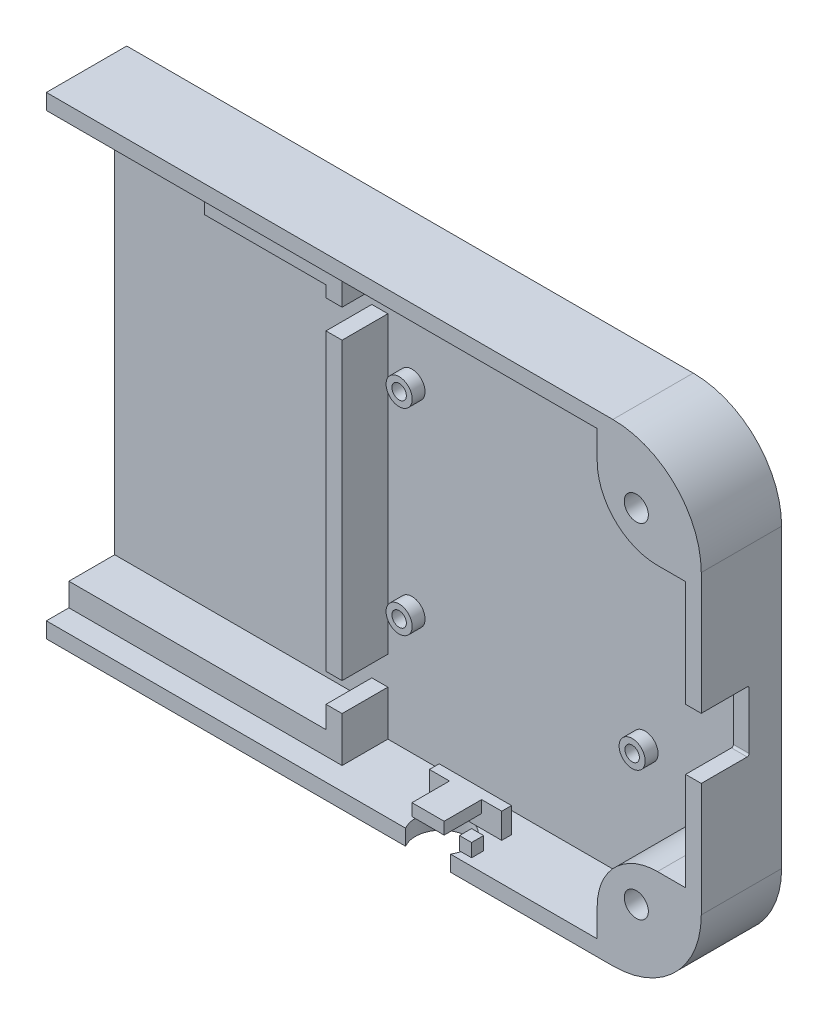
from build123d import *

# Parameters (mm, degrees)
SKETCH1_W               = 326
SKETCH1_H               = 117.8
SKETCH1_W_2             = 318.2
SKETCH1_H_2             = 110
BOSS_EXTRUDE1_DEPTH     = 20
SKETCH1_3_W             = 318.2
SKETCH1_3_H             = 110
BOSS_EXTRUDE2_DEPTH     = 3
BOSS_EXTRUDE6_START     = 3
SKETCH6_R               = 3.25
SKETCH6_R_2             = 1.8
BOSS_EXTRUDE6_DEPTH     = 3.2
FILLET1_R               = 22
CUT_EXTRUDE3_START      = 163
CUT_EXTRUDE3_DEPTH      = 3.9
CUT_EXTRUDE4_START      = 1.2
SKETCH6_2_R             = 1.8
CUT_EXTRUDE4_DEPTH      = 1.8
SKETCH5_W               = 64.404478897
SKETCH5_H               = 11.204693833
SKETCH5_W_2             = 4
SKETCH5_H_2             = 98.795306167
SKETCH5_W_3             = 30.218685567
SKETCH5_H_3             = 8.375486052
SKETCH5_H_4             = 73.388395798
SKETCH5_W_4             = 147.589311785
SKETCH5_H_5             = 5.740206696
BOSS_EXTRUDE7_DEPTH     = 14.4
CUT_EXTRUDE5_START      = -58.9
SKETCH10_R              = 6.5
CUT_EXTRUDE5_DEPTH      = 3.9
BOSS_EXTRUDE8_START     = -55
SKETCH11_W              = 18
SKETCH11_H              = 2.429995135
SKETCH11_W_2            = 3
SKETCH11_H_2            = 3
BOSS_EXTRUDE8_DEPTH     = 3.3
BOSS_EXTRUDE9_START     = -51.7
BOSS_EXTRUDE9_DEPTH     = 3
BOSS_EXTRUDE10_START    = 3
SKETCH12_R              = 3
BOSS_EXTRUDE10_DEPTH    = 17
SKETCH12_3_R            = 3
CUT_EXTRUDE6_DEPTH      = 6
SKETCH13_R              = 4.5
CUT_EXTRUDE7_DEPTH      = 4
CUT_EXTRUDE8_DEPTH      = 30
CUT_EXTRUDE8_DEPTH_BACK = 40
SKETCH14_W              = 179.941396495
SKETCH14_H              = 132.266113534


with BuildPart() as part:
    # Sketch1 → Boss-Extrude1 (new body)
    with BuildSketch(Plane.XY):
        Rectangle(SKETCH1_W, SKETCH1_H)
        Rectangle(SKETCH1_W_2, SKETCH1_H_2, mode=Mode.SUBTRACT)
    extrude(amount=BOSS_EXTRUDE1_DEPTH)

    # Sketch1<3> → Boss-Extrude2 (add)
    with BuildSketch(Plane.XY):
        Rectangle(SKETCH1_3_W, SKETCH1_3_H)
    extrude(amount=BOSS_EXTRUDE2_DEPTH)

    # Sketch6 → Boss-Extrude6 (add)
    # profile 1 of 4: a face of its own
    with BuildSketch(Plane.XY.offset(BOSS_EXTRUDE6_START)):
        with Locations((132, -24.5)):
            Circle(SKETCH6_R)
        with Locations((132, -24.5)):
            Circle(SKETCH6_R_2, mode=Mode.SUBTRACT)
    # profile 2 of 4: a face of its own
    with BuildSketch(Plane.XY.offset(BOSS_EXTRUDE6_START)):
        with Locations((74, -24.5)):
            Circle(SKETCH6_R)
        with Locations((74, -24.5)):
            Circle(SKETCH6_R_2, mode=Mode.SUBTRACT)
    # profile 3 of 4: a face of its own
    with BuildSketch(Plane.XY.offset(BOSS_EXTRUDE6_START)):
        with Locations((74, 24.5)):
            Circle(SKETCH6_R)
        with Locations((74, 24.5)):
            Circle(SKETCH6_R_2, mode=Mode.SUBTRACT)
    # profile 4 of 4: a face of its own
    with BuildSketch(Plane.XY.offset(BOSS_EXTRUDE6_START)):
        with Locations((132, 24.5)):
            Circle(SKETCH6_R)
        with Locations((132, 24.5)):
            Circle(SKETCH6_R_2, mode=Mode.SUBTRACT)
    extrude(amount=BOSS_EXTRUDE6_DEPTH)

    # Fillet1
    fillet1_edges = [part.edges().sort_by_distance(p)[0] for p in [
        (163, 58.9, 10),
        (163, -58.9, 10),
        (-163, -58.9, 10),
        (-163, 58.9, 10),
        (159.1, 55, 11.5),
        (-159.1, 55, 11.5),
        (-159.1, -55, 11.5),
        (159.1, -55, 11.5),
    ]]
    fillet(fillet1_edges, radius=FILLET1_R)

    # Sketch9 → Cut-Extrude3 (cut)
    with BuildSketch(Plane(origin=(0, 0, 0), x_dir=(0, 0, -1), z_dir=(1, 0, 0)).offset(CUT_EXTRUDE3_START)):
        with BuildLine():
            Line((-20, -8.55), (-8.58, -8.55))
            ThreePointArc((-8.58, -8.55), (-8.226446609, -8.403553391), (-8.08, -8.05))
            Line((-8.08, -8.05), (-8.08, 6.05))
            ThreePointArc((-8.08, 6.05), (-8.226446609, 6.403553391), (-8.58, 6.55))
            Line((-8.58, 6.55), (-20, 6.55))
            Line((-20, 6.55), (-20, -8.55))
        make_face()
    extrude(amount=-CUT_EXTRUDE3_DEPTH, mode=Mode.SUBTRACT)

    # Sketch6<2> → Cut-Extrude4 (cut)
    with BuildSketch(Plane.XY.offset(CUT_EXTRUDE4_START)):
        with Locations((132, -24.5)):
            Circle(SKETCH6_2_R)
        with Locations((132, 24.5)):
            Circle(SKETCH6_2_R)
        with Locations((74, 24.5)):
            Circle(SKETCH6_2_R)
        with Locations((74, -24.5)):
            Circle(SKETCH6_2_R)
    extrude(amount=CUT_EXTRUDE4_DEPTH, mode=Mode.SUBTRACT)

    # Sketch5 → Boss-Extrude7 (add)
    with BuildSketch(Plane.XY):
        with Locations((-66.797760552, 49.397653084)):
            Rectangle(SKETCH5_W, SKETCH5_H)
        with Locations((-101, 5.602346917)):
            Rectangle(SKETCH5_W_2, SKETCH5_H_2)
        with Locations((48.890657217, 50.812256974)):
            Rectangle(SKETCH5_W_3, SKETCH5_H_3)
        with Locations((66, 49.397653084)):
            Rectangle(SKETCH5_W_2, SKETCH5_H)
        with Locations((66, 0)):
            Rectangle(SKETCH5_W_2, SKETCH5_H_4)
        with Locations((-9.794655893, -52.129896652)):
            Rectangle(SKETCH5_W_4, SKETCH5_H_5)
        with Locations((66, -49.397653084)):
            Rectangle(SKETCH5_W_2, SKETCH5_H)
    extrude(amount=BOSS_EXTRUDE7_DEPTH)

    # Sketch10 → Cut-Extrude5 (cut)
    with BuildSketch(Plane(origin=(0, 0, 0), x_dir=(1, 0, 0), z_dir=(0, 1, 0)).offset(CUT_EXTRUDE5_START)):
        with Locations((95, -16.665643961)):
            Circle(SKETCH10_R)
        with Locations((-95, -16.665643961)):
            Circle(SKETCH10_R)
    extrude(amount=CUT_EXTRUDE5_DEPTH, mode=Mode.SUBTRACT)

    # Sketch11 → Boss-Extrude8 (add)
    with BuildSketch(Plane(origin=(0, 0, 0), x_dir=(1, 0, 0), z_dir=(0, 1, 0)).offset(BOSS_EXTRUDE8_START)):
        Polygon((-104.033941149, -14.931036323), (-101.03394878, -14.937802738), (-101.040715195, -17.937795107), (-104.040707565, -17.931028692), align=None)
        Polygon((-86.018356525, -8.041657306), (-104.018310741, -8.001058815), (-104.023791526, -10.431047769), (-86.023837311, -10.47164626), align=None)
        with Locations((95, -9.450646394)):
            Rectangle(SKETCH11_W, SKETCH11_H)
        with Locations((102.5, -16.665643961)):
            Rectangle(SKETCH11_W_2, SKETCH11_H_2)
    extrude(amount=BOSS_EXTRUDE8_DEPTH)

    # Sketch11<3> → Boss-Extrude9 (add)
    with BuildSketch(Plane(origin=(0, 0, 0), x_dir=(1, 0, 0), z_dir=(0, 1, 0)).offset(BOSS_EXTRUDE9_START)):
        Polygon((86, -8.235648826), (86, -10.665643961), (91, -10.665643961), (91, -20), (99, -20), (99, -10.665643961), (104, -10.665643961), (104, -8.235648826), align=None)
        Polygon((-104.023791526, -10.431047769), (-99.023804244, -10.442325128), (-99.044857621, -19.776657424), (-91.044877969, -19.794701198), (-91.023824593, -10.460368902), (-86.023837311, -10.47164626), (-86.018356525, -8.041657306), (-104.018310741, -8.001058815), align=None)
    extrude(amount=BOSS_EXTRUDE9_DEPTH)

    # Sketch12 → Boss-Extrude10 (add)
    # profile 1 of 4: a face of its own
    with BuildSketch(Plane.XY.offset(BOSS_EXTRUDE10_START)):
        with BuildLine():
            Line((-137.1, -55), (-137.1, -48))
            ThreePointArc((-137.1, -48), (-141.493398282, -37.393398282), (-152.1, -33))
            Line((-152.1, -33), (-159.1, -33))
            ThreePointArc((-159.1, -33), (-152.656349186, -48.556349186), (-137.1, -55))
        make_face()
        with Locations((-146.828174593, -42.728174593)):
            Circle(SKETCH12_R, mode=Mode.SUBTRACT)
    # profile 2 of 4: a face of its own
    with BuildSketch(Plane.XY.offset(BOSS_EXTRUDE10_START)):
        with BuildLine():
            ThreePointArc((-137.1, 48), (-141.493398282, 37.393398282), (-152.1, 33))
            Line((-152.1, 33), (-159.1, 33))
            ThreePointArc((-159.1, 33), (-152.656349186, 48.556349186), (-137.1, 55))
            Line((-137.1, 55), (-137.1, 48))
        make_face()
        with Locations((-146.828174593, 42.728174593)):
            Circle(SKETCH12_R, mode=Mode.SUBTRACT)
    # profile 3 of 4: a face of its own
    with BuildSketch(Plane.XY.offset(BOSS_EXTRUDE10_START)):
        with BuildLine():
            ThreePointArc((152.1, 33), (141.493398282, 37.393398282), (137.1, 48))
            Line((137.1, 48), (137.1, 55))
            ThreePointArc((137.1, 55), (152.656349186, 48.556349186), (159.1, 33))
            Line((159.1, 33), (152.1, 33))
        make_face()
        with Locations((146.828174593, 42.728174593)):
            Circle(SKETCH12_R, mode=Mode.SUBTRACT)
    # profile 4 of 4: a face of its own
    with BuildSketch(Plane.XY.offset(BOSS_EXTRUDE10_START)):
        with BuildLine():
            ThreePointArc((137.1, -48), (141.493398282, -37.393398282), (152.1, -33))
            Line((152.1, -33), (159.1, -33))
            ThreePointArc((159.1, -33), (152.656349186, -48.556349186), (137.1, -55))
            Line((137.1, -55), (137.1, -48))
        make_face()
        with Locations((146.828174593, -42.728174593)):
            Circle(SKETCH12_R, mode=Mode.SUBTRACT)
    extrude(amount=BOSS_EXTRUDE10_DEPTH)

    # Sketch12<3> → Cut-Extrude6 (cut)
    with BuildSketch(Plane.XY):
        with Locations((146.828174593, 42.728174593)):
            Circle(SKETCH12_3_R)
        with Locations((146.828174593, -42.728174593)):
            Circle(SKETCH12_3_R)
        with Locations((-146.828174593, -42.728174593)):
            Circle(SKETCH12_3_R)
        with Locations((-146.828174593, 42.728174593)):
            Circle(SKETCH12_3_R)
    extrude(amount=CUT_EXTRUDE6_DEPTH, mode=Mode.SUBTRACT)

    # Sketch13 → Cut-Extrude7 (cut)
    with BuildSketch(Plane.XY):
        with Locations((-146.828174593, -42.728174593)):
            Circle(SKETCH13_R)
        with Locations((-146.828174593, 42.728174593)):
            Circle(SKETCH13_R)
        with Locations((146.828174593, 42.728174593)):
            Circle(SKETCH13_R)
        with Locations((146.828174593, -42.728174593)):
            Circle(SKETCH13_R)
    extrude(amount=CUT_EXTRUDE7_DEPTH, mode=Mode.SUBTRACT)

    # Sketch14 → Cut-Extrude8 (cut, two sides: drawn at the far end of the back side and taken through both)
    with BuildSketch(Plane.XY.offset(-CUT_EXTRUDE8_DEPTH_BACK)):
        with Locations((-89.970698248, -3.418642863)):
            Rectangle(SKETCH14_W, SKETCH14_H)
    extrude(amount=CUT_EXTRUDE8_DEPTH + CUT_EXTRUDE8_DEPTH_BACK, mode=Mode.SUBTRACT)


solid = part.part
